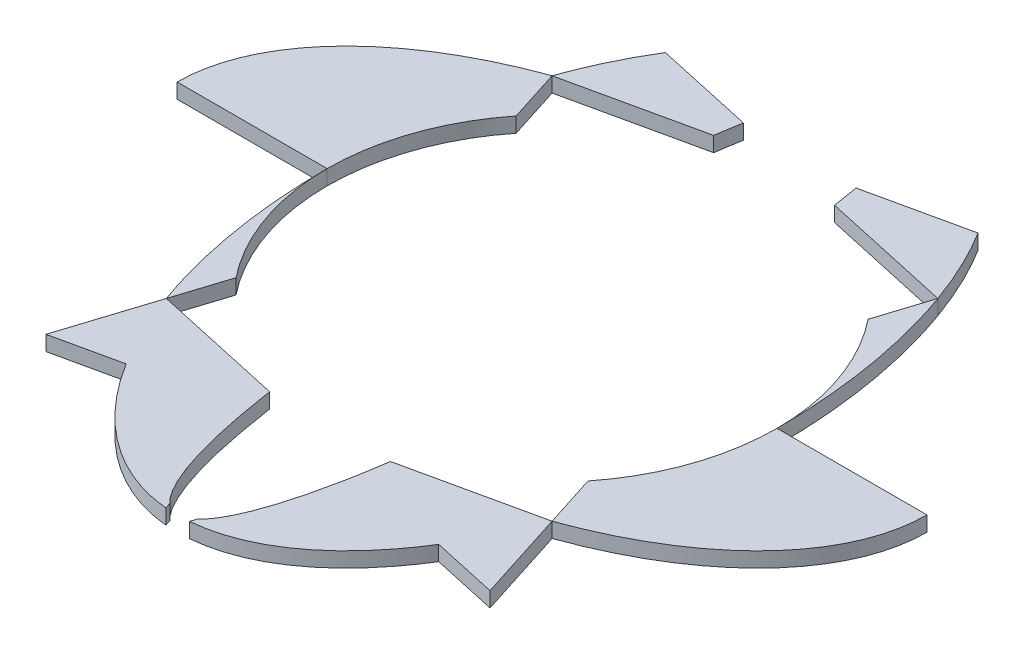
from build123d import *

# Parameters (mm, degrees)
DODANIE_WYCI_GNI_CIE1_DEPTH   = 2
DODANIE_WYCI_GNI_CIE1_2_DEPTH = 2
DODANIE_WYCI_GNI_CIE1_3_DEPTH = 2
DODANIE_WYCI_GNI_CIE1_4_DEPTH = 2
DODANIE_WYCI_GNI_CIE1_5_DEPTH = 2
DODANIE_WYCI_GNI_CIE1_6_DEPTH = 2
DODANIE_WYCI_GNI_CIE1_7_DEPTH = 2
DODANIE_WYCI_GNI_CIE1_8_DEPTH = 2


with BuildPart() as part:
    # Szkic1 → Dodanie-wyciągnięcie1 (new body)
    with BuildSketch(Plane(origin=(0, 0, 0), x_dir=(1, 0, 0), z_dir=(0, 1, 0))):
        with BuildLine():
            Line((-25.724787771, 25.724787771), (-8.05822964, 29.607826273))
            add(Edge.make_bspline(
                [(-7.507535684, 33.029118956), (-7.79792239, 31.378992774), (-8.05822964, 29.607826273)],
                knots=[0.849202104, 0.849202104, 0.849202104, 0.937063931, 0.937063931, 0.937063931], degree=2, weights=[1, 0.999035193, 1]))
            Line((-7.507535684, 33.029118956), (-20.843852414, 35.960387795))
            add(Edge.make_bspline(
                [(-20.843852414, 35.960387795), (-23.68927397, 31.378992774), (-25.724787771, 25.724787771)],
                knots=[3.909727591, 3.909727591, 3.909727591, 4.17196948, 4.17196948, 4.17196948], degree=2, weights=[1, 0.991415958, 1]))
        make_face()
    extrude(amount=DODANIE_WYCI_GNI_CIE1_DEPTH)


with BuildPart() as body_2:
    # Szkic1 → Dodanie-wyci_gni_cie1 2 (new body)
    with BuildSketch(Plane(origin=(0, 0, 0), x_dir=(1, 0, 0), z_dir=(0, 1, 0))):
        with BuildLine():
            Line((-23.475270357, 18.679177757), (-25.724787771, 25.724787771))
            add(Edge.make_bspline(
                [(-25.724787771, 25.724787771), (-50, 16.985711369), (-50, 0)],
                knots=[2.111215827, 2.111215827, 2.111215827, 3.141592654, 3.141592654, 3.141592654], degree=2, weights=[1, 0.870199907, 1]))
            Line((-50, 0), (-30, 0))
            ThreePointArc((-30, 9.5e-08), (-28.321882961, 9.892974554), (-23.475270357, 18.679177757))
        make_face()
    extrude(amount=DODANIE_WYCI_GNI_CIE1_2_DEPTH)


with BuildPart() as body_3:
    # Szkic1 → Dodanie-wyci_gni_cie1 3 (new body)
    with BuildSketch(Plane(origin=(0, 0, 0), x_dir=(1, 0, 0), z_dir=(0, 1, 0))):
        with BuildLine():
            ThreePointArc((-23.475270357, -18.679177757), (-28.321882992, -9.892974465), (-30, 9.5e-08))
            add(Edge.make_bspline(
                [(-30, 9.5e-08), (-30.000000016, -13.849198204), (-25.724787771, -25.724787771)],
                knots=[4.712388978, 4.712388978, 4.712388978, 5.252808481, 5.252808481, 5.252808481], degree=2, weights=[1, 0.963714928, 1]))
            Line((-25.724787771, -25.724787771), (-23.475270357, -18.679177757))
        make_face()
    extrude(amount=DODANIE_WYCI_GNI_CIE1_3_DEPTH)


with BuildPart() as body_4:
    # Szkic1 → Dodanie-wyci_gni_cie1 4 (new body)
    with BuildSketch(Plane(origin=(0, 0, 0), x_dir=(1, 0, 0), z_dir=(0, 1, 0))):
        with BuildLine():
            Line((-29.607826273, -37.88667404), (-20.843852414, -35.960387795))
            add(Edge.make_bspline(
                [(-20.843852414, -35.960387795), (-12.774167321, -48.953336072), (-1.56928672, -49.931545896)],
                knots=[5.51505037, 5.51505037, 5.51505037, 6.230851865, 6.230851865, 6.230851865], degree=2, weights=[1, 0.936634273, 1]))
            Line((-1.56928672, -49.931545896), (-1.811566447, -49.17271271))
            add(Edge.make_bspline(
                [(-7.507535684, -33.029118956), (-5.218865934, -46.034514162), (-1.811566447, -49.17271271)],
                knots=[2.292390549, 2.292390549, 2.292390549, 2.959430225, 2.959430225, 2.959430225], degree=2, weights=[1, 0.944895907, 1]))
            add(Edge.make_bspline(
                [(-8.05822964, -29.607826273), (-7.79792239, -31.378992774), (-7.507535684, -33.029118956)],
                knots=[2.204528722, 2.204528722, 2.204528722, 2.292390549, 2.292390549, 2.292390549], degree=2, weights=[1, 0.999035193, 1]))
            Line((-8.05822964, -29.607826273), (-25.724787771, -25.724787771))
            Line((-25.724787771, -25.724787771), (-29.607826273, -37.88667404))
        make_face()
    extrude(amount=DODANIE_WYCI_GNI_CIE1_4_DEPTH)


with BuildPart() as body_5:
    # Szkic1 → Dodanie-wyci_gni_cie1 5 (new body)
    with BuildSketch(Plane(origin=(0, 0, 0), x_dir=(1, 0, 0), z_dir=(0, 1, 0))):
        with BuildLine():
            Line((8.05822964, 29.607826273), (25.724787771, 25.724787771))
            add(Edge.make_bspline(
                [(25.724787771, 25.724787771), (23.68927397, 31.378992774), (20.843852414, 35.960387795)],
                knots=[2.111215827, 2.111215827, 2.111215827, 2.373457716, 2.373457716, 2.373457716], degree=2, weights=[1, 0.991415958, 1]))
            Line((20.843852414, 35.960387795), (7.507535684, 33.029118956))
            add(Edge.make_bspline(
                [(8.05822964, 29.607826273), (7.79792239, 31.378992774), (7.507535684, 33.029118956)],
                knots=[5.346121376, 5.346121376, 5.346121376, 5.433983203, 5.433983203, 5.433983203], degree=2, weights=[1, 0.999035193, 1]))
        make_face()
    extrude(amount=DODANIE_WYCI_GNI_CIE1_5_DEPTH)


with BuildPart() as body_6:
    # Szkic1 → Dodanie-wyci_gni_cie1 6 (new body)
    with BuildSketch(Plane(origin=(0, 0, 0), x_dir=(1, 0, 0), z_dir=(0, 1, 0))):
        with BuildLine():
            add(Edge.make_bspline(
                [(30, 0), (30, 13.849198247), (25.724787771, 25.724787771)],
                knots=[1.570796327, 1.570796327, 1.570796327, 2.111215827, 2.111215827, 2.111215827], degree=2, weights=[1, 0.963714928, 1]))
            Line((25.724787771, 25.724787771), (23.475270357, 18.679177757))
            ThreePointArc((23.475270357, 18.679177757), (28.321882977, 9.89297451), (30, 0))
        make_face()
    extrude(amount=DODANIE_WYCI_GNI_CIE1_6_DEPTH)


with BuildPart() as body_7:
    # Szkic1 → Dodanie-wyci_gni_cie1 7 (new body)
    with BuildSketch(Plane(origin=(0, 0, 0), x_dir=(1, 0, 0), z_dir=(0, 1, 0))):
        with BuildLine():
            Line((25.724787771, -25.724787771), (8.05822964, -29.607826273))
            add(Edge.make_bspline(
                [(7.507535684, -33.029118956), (7.79792239, -31.378992774), (8.05822964, -29.607826273)],
                knots=[3.990794758, 3.990794758, 3.990794758, 4.078656585, 4.078656585, 4.078656585], degree=2, weights=[1, 0.999035193, 1]))
            add(Edge.make_bspline(
                [(1.811566447, -49.17271271), (5.218865934, -46.034514162), (7.507535684, -33.029118956)],
                knots=[3.323755082, 3.323755082, 3.323755082, 3.990794758, 3.990794758, 3.990794758], degree=2, weights=[1, 0.944895907, 1]))
            Line((1.811566447, -49.17271271), (1.56928672, -49.931545896))
            add(Edge.make_bspline(
                [(1.56928672, -49.931545896), (12.774167321, -48.953336072), (20.843852414, -35.960387795)],
                knots=[0.052333442, 0.052333442, 0.052333442, 0.768134938, 0.768134938, 0.768134938], degree=2, weights=[1, 0.936634273, 1]))
            Line((20.843852414, -35.960387795), (29.607826273, -37.88667404))
            Line((29.607826273, -37.88667404), (25.724787771, -25.724787771))
        make_face()
    extrude(amount=DODANIE_WYCI_GNI_CIE1_7_DEPTH)


with BuildPart() as body_8:
    # Szkic1 → Dodanie-wyci_gni_cie1 8 (new body)
    with BuildSketch(Plane(origin=(0, 0, 0), x_dir=(1, 0, 0), z_dir=(0, 1, 0))):
        with BuildLine():
            Line((23.475270357, -18.679177757), (25.724787771, -25.724787771))
            add(Edge.make_bspline(
                [(25.724787771, -25.724787771), (50, -16.985711369), (50, 0)],
                knots=[5.252808481, 5.252808481, 5.252808481, 6.283185307, 6.283185307, 6.283185307], degree=2, weights=[1, 0.870199907, 1]))
            Line((50, 0), (30, 0))
            ThreePointArc((30, 0), (28.321882977, -9.89297451), (23.475270357, -18.679177757))
        make_face()
    extrude(amount=DODANIE_WYCI_GNI_CIE1_8_DEPTH)


solid = Compound([part.part, body_2.part, body_3.part, body_4.part, body_5.part, body_6.part, body_7.part, body_8.part])
